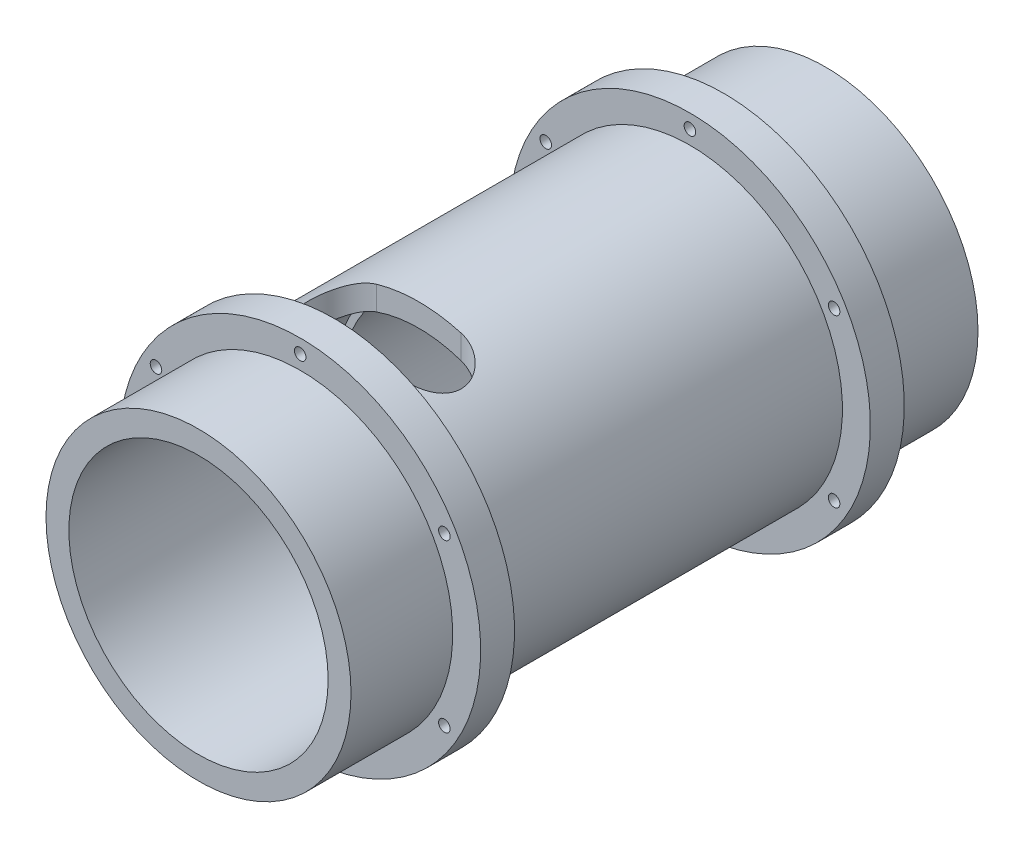
from build123d import *

# Parameters (mm, degrees)
SKETCH1_R            = 45
SKETCH1_R_2          = 33.75
BOSS_EXTRUDE1_DEPTH  = 92.5
SKETCH4_W            = 10
SKETCH4_H            = 8.25
CUT_EXTRUDE1_DEPTH   = 120.278560521
M3_CLEARANCE_HOLE1_D = 3.4
CIRPATTERN1_COUNT    = 6


with BuildPart() as part:
    # Sketch1 → Boss-Extrude1 (new, symmetric)
    with BuildSketch(Plane.XY):
        Circle(SKETCH1_R)
        Circle(SKETCH1_R_2, mode=Mode.SUBTRACT)
    extrude(amount=BOSS_EXTRUDE1_DEPTH, both=True)

    # Sketch2 → Cut-Revolve1 (revolve, cut)
    with BuildSketch(Plane(origin=(0, 0, 0), x_dir=(1, 0, 0), z_dir=(0, 1, 0)), mode=Mode.PRIVATE) as cut_revolve1_sk:
        Polygon((0, -92.5), (0, 92.5), (-38.25, 92.5), (-38.25, 86.15), (-36.25, 86.15), (-36.25, -13.85), (-38.25, -13.85), (-38.25, -92.5), align=None)
    revolve(cut_revolve1_sk.sketch.rotate(Axis((0, 0, 92.5), (0, 0, -1)), 180), axis=Axis((0, 0, 92.5), (0, 0, -1)), mode=Mode.SUBTRACT)

    # Sketch4 → Revolve1 (revolve)
    with BuildSketch(Plane(origin=(0, 0, 0), x_dir=(0, 0, -1), z_dir=(1, 0, 0)), mode=Mode.PRIVATE) as revolve1_sk:
        with Locations((-57.5, 49.125)):
            Rectangle(SKETCH4_W, SKETCH4_H)
        with Locations((57.5, 49.125)):
            Rectangle(SKETCH4_W, SKETCH4_H)
    revolve(revolve1_sk.sketch.rotate(Axis((0, 0, -92.5), (0, 0, 1)), 90), axis=Axis((0, 0, -92.5), (0, 0, 1)))

    # Sketch3 → Cut-Extrude1 (cut, through all)
    with BuildSketch(Plane(origin=(0, 0, 0), x_dir=(1, 0, 0), z_dir=(0, 1, 0))):
        with BuildLine():
            Line((-12.5, -27.5), (12.5, -27.5))
            ThreePointArc((12.5, -27.5), (22.5, -37.5), (12.5, -47.5))
            Line((12.5, -47.5), (-12.5, -47.5))
            ThreePointArc((-12.5, -47.5), (-22.5, -37.5), (-12.5, -27.5))
        make_face()
    extrude(amount=CUT_EXTRUDE1_DEPTH, mode=Mode.SUBTRACT)

    # M3 Clearance Hole1 (through all)
    with Locations(Plane.XY.offset(62.5)):
        with Locations((0, 49.125)):
            m3_clearance_hole1 = Hole(M3_CLEARANCE_HOLE1_D / 2)

    # CirPattern1: M3 Clearance Hole1 ×6 about axis
    cirpattern1_axis = Axis((0, 0, 0), (0, 0, 1))
    for i in range(1, CIRPATTERN1_COUNT):
        add(m3_clearance_hole1.rotate(cirpattern1_axis, i * 360 / CIRPATTERN1_COUNT), mode=Mode.SUBTRACT)


solid = part.part
